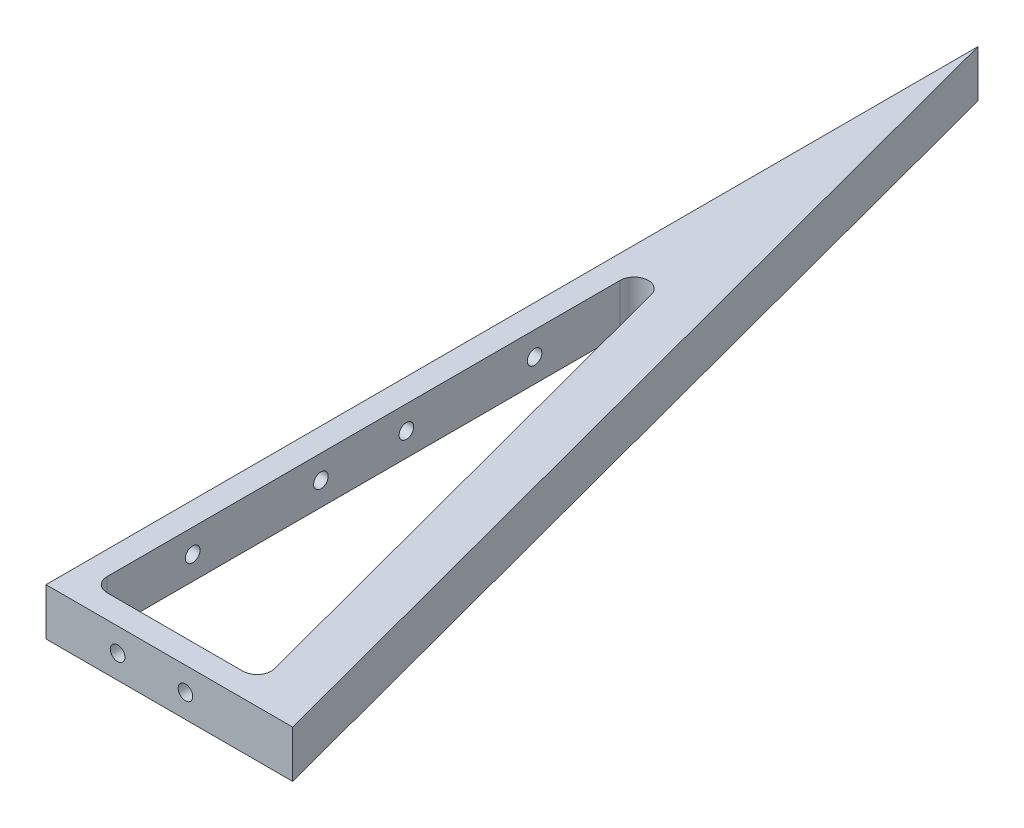
from build123d import *

# Parameters (mm, degrees)
BOSS_EXTRUDE1_DEPTH = 10
SKETCH2_R           = 1.55
CUT_EXTRUDE1_DEPTH  = 7
SKETCH3_R           = 1.55
CUT_EXTRUDE2_DEPTH  = 7


with BuildPart() as part:
    # Sketch1 → Boss-Extrude1 (new body)
    with BuildSketch(Plane(origin=(0, 0, 0), x_dir=(1, 0, 0), z_dir=(0, 1, 0))):
        Polygon((0, 0), (0, 198), (52.4, 0), align=None)
        with BuildLine():
            Line((5, 8), (5, 116.957761971))
            ThreePointArc((5, 116.957761971), (7.613008346, 119.932696838), (10.900158307, 117.725278614))
            Line((10.900158307, 117.725278614), (39.735444808, 8.767516643))
            ThreePointArc((39.735444808, 8.767516643), (39.212527542, 6.170047805), (36.835286501, 5))
            Line((36.835286501, 5), (8, 5))
            ThreePointArc((8, 5), (5.878679656, 5.878679656), (5, 8))
        make_face(mode=Mode.SUBTRACT)
    extrude(amount=BOSS_EXTRUDE1_DEPTH)

    # Sketch2 → Cut-Extrude1 (cut)
    with BuildSketch(Plane(origin=(0, 0, -5), x_dir=(-1, 0, 0), z_dir=(0, 0, -1))):
        with Locations((-15.207643251, 5)):
            Circle(SKETCH2_R)
        with Locations((-29.627643251, 5)):
            Circle(SKETCH2_R)
    extrude(amount=-CUT_EXTRUDE1_DEPTH, mode=Mode.SUBTRACT)

    # Sketch3 → Cut-Extrude2 (cut)
    with BuildSketch(Plane(origin=(5, 0, 0), x_dir=(0, 0, -1), z_dir=(1, 0, 0))):
        with Locations((98.797761971, 5)):
            Circle(SKETCH3_R)
        with Locations((71.557761971, 5)):
            Circle(SKETCH3_R)
        with Locations((53.4, 5)):
            Circle(SKETCH3_R)
        with Locations((26.16, 5)):
            Circle(SKETCH3_R)
    extrude(amount=-CUT_EXTRUDE2_DEPTH, mode=Mode.SUBTRACT)


solid = part.part
